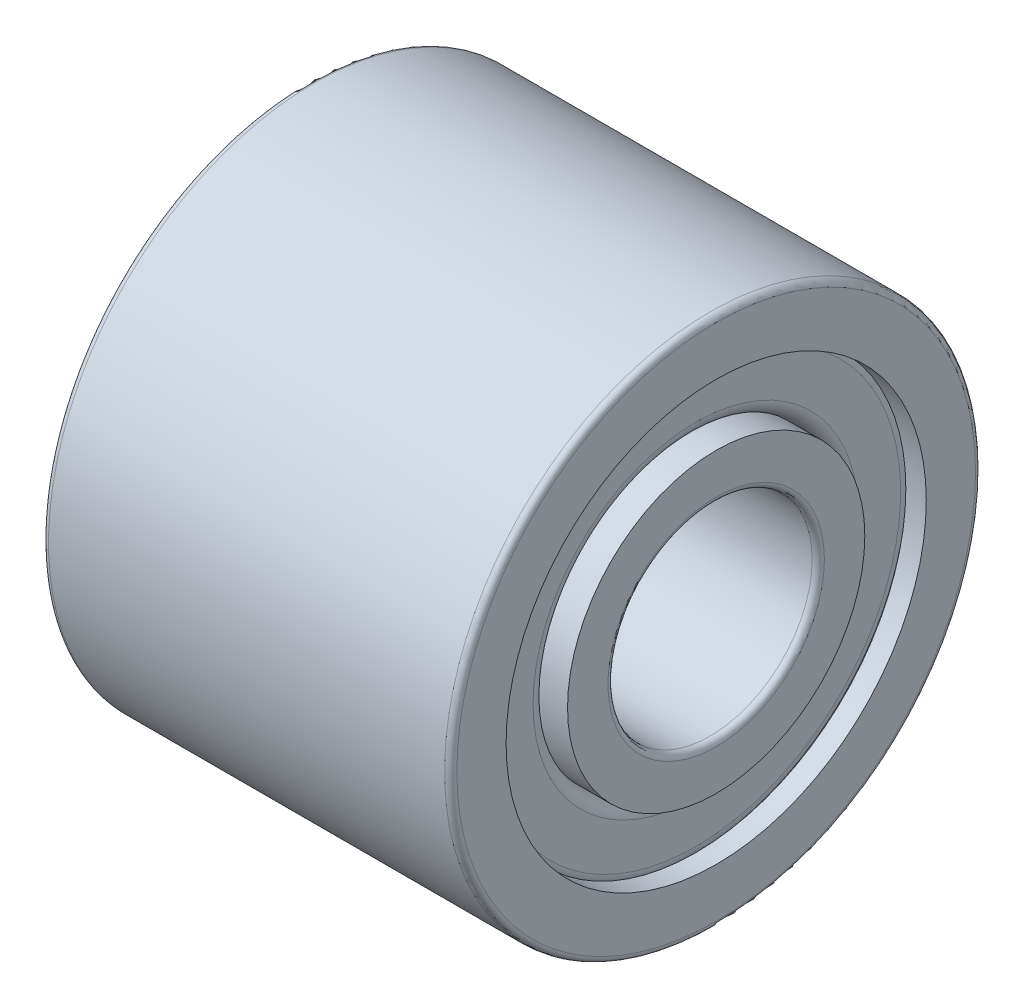
from build123d import *


with BuildPart() as part:
    # OutRacSke → OuterRace (revolve)
    with BuildSketch(Plane.XY):
        with BuildLine():
            Line((-4.5, 5.36), (-4.5, 5.145))
            Line((-4.5, 5.145), (-5, 5.145))
            Line((-5, 5.145), (-5, 6.35))
            ThreePointArc((-5, 6.35), (-4.956066017, 6.456066017), (-4.85, 6.5))
            Line((-4.85, 6.5), (4.85, 6.5))
            ThreePointArc((4.85, 6.5), (4.956066017, 6.456066017), (5, 6.35))
            Line((5, 6.35), (5, 5.145))
            Line((5, 5.145), (4.5, 5.145))
            Line((4.5, 5.145), (4.5, 5.36))
            Line((4.5, 5.36), (-4.5, 5.36))
        make_face()
    revolve(axis=Axis((-7.9375, 0, 0), (1, 0, 0)))

    # RolSimSke → RollersSimplified (revolve)
    with BuildSketch(Plane(origin=(0, 25.4, 0), x_dir=(1, 0, 0), z_dir=(0, 0, 1))):
        with BuildLine():
            Line((-4.5, -20.3832), (-4.5, -21.4158))
            ThreePointArc((-4.5, -21.4158), (-4.399186154, -21.659186154), (-4.1558, -21.76))
            Line((-4.1558, -21.76), (4.1558, -21.76))
            ThreePointArc((4.1558, -21.76), (4.399186154, -21.659186154), (4.5, -21.4158))
            Line((4.5, -21.4158), (4.5, -20.3832))
            ThreePointArc((4.5, -20.3832), (4.399186154, -20.139813846), (4.1558, -20.039))
            Line((4.1558, -20.039), (-4.1558, -20.039))
            ThreePointArc((-4.1558, -20.039), (-4.399186154, -20.139813846), (-4.5, -20.3832))
        make_face()
    revolve(axis=Axis((-25.4, 0, 0), (1, 0, 0)))

    # InsRacSke → InnerRace (revolve)
    with BuildSketch(Plane.XY):
        with BuildLine():
            Line((-5, 3.64), (-5, 2.65))
            ThreePointArc((-5, 2.65), (-4.956066017, 2.543933983), (-4.85, 2.5))
            Line((-4.85, 2.5), (4.85, 2.5))
            ThreePointArc((4.85, 2.5), (4.956066017, 2.543933983), (5, 2.65))
            Line((5, 2.65), (5, 3.64))
            Line((5, 3.64), (-5, 3.64))
        make_face()
    revolve(axis=Axis((-7.9375, 0, 0), (1, 0, 0)))


solid = part.part
